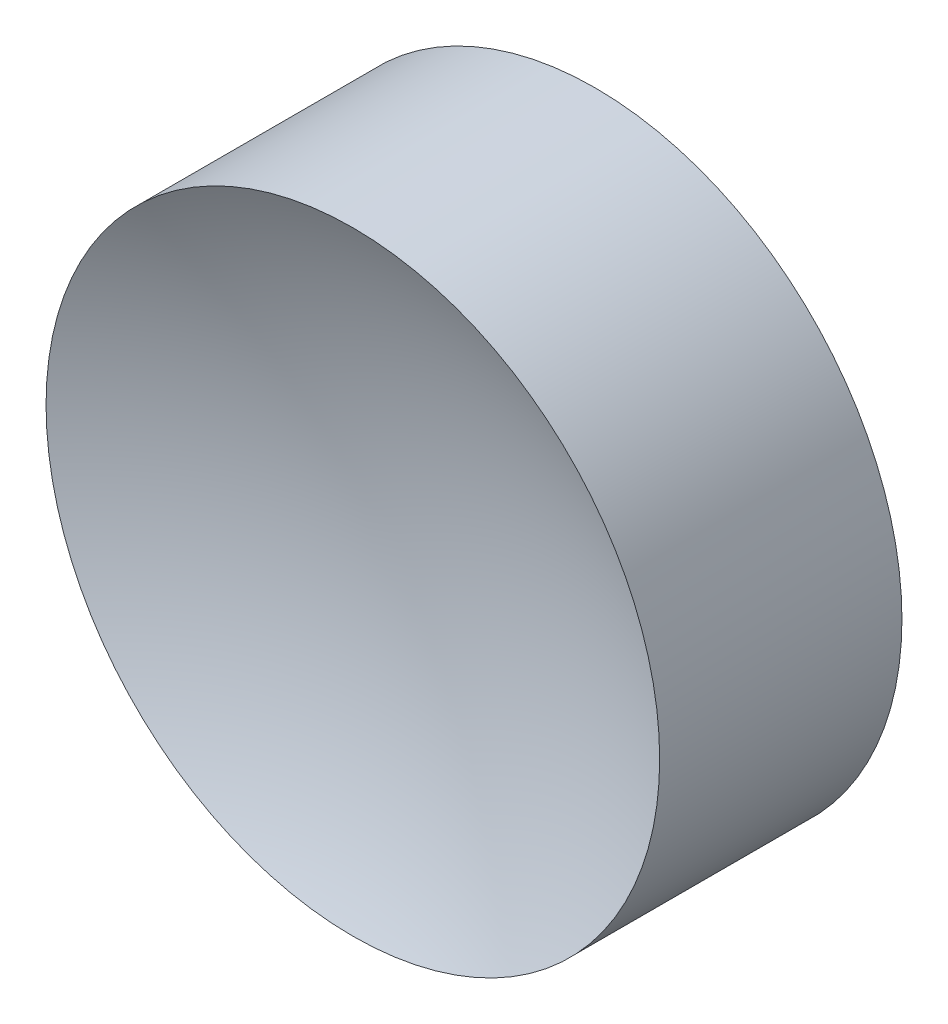
from build123d import *


with BuildPart() as part:
    # 草图1 → 旋转1 (revolve)
    with BuildSketch(Plane(origin=(0, 0, 0), x_dir=(1, 0, 0), z_dir=(0, 1, 0)), mode=Mode.PRIVATE) as revolve_1_sk:
        with BuildLine():
            Line((0, 0), (0, 3.8))
            ThreePointArc((0, 3.8), (-6.165499924, 4.519121406), (-12, 6.637879008))
            Line((-12, 6.637879008), (-12, -2.837879008))
            ThreePointArc((-12, -2.837879008), (-6.165499924, -0.719121406), (0, 0))
        make_face()
    revolve(revolve_1_sk.sketch.rotate(Axis((0, 0, 0), (0, 0, -1)), 180), axis=Axis((0, 0, 0), (0, 0, -1)))


solid = part.part
